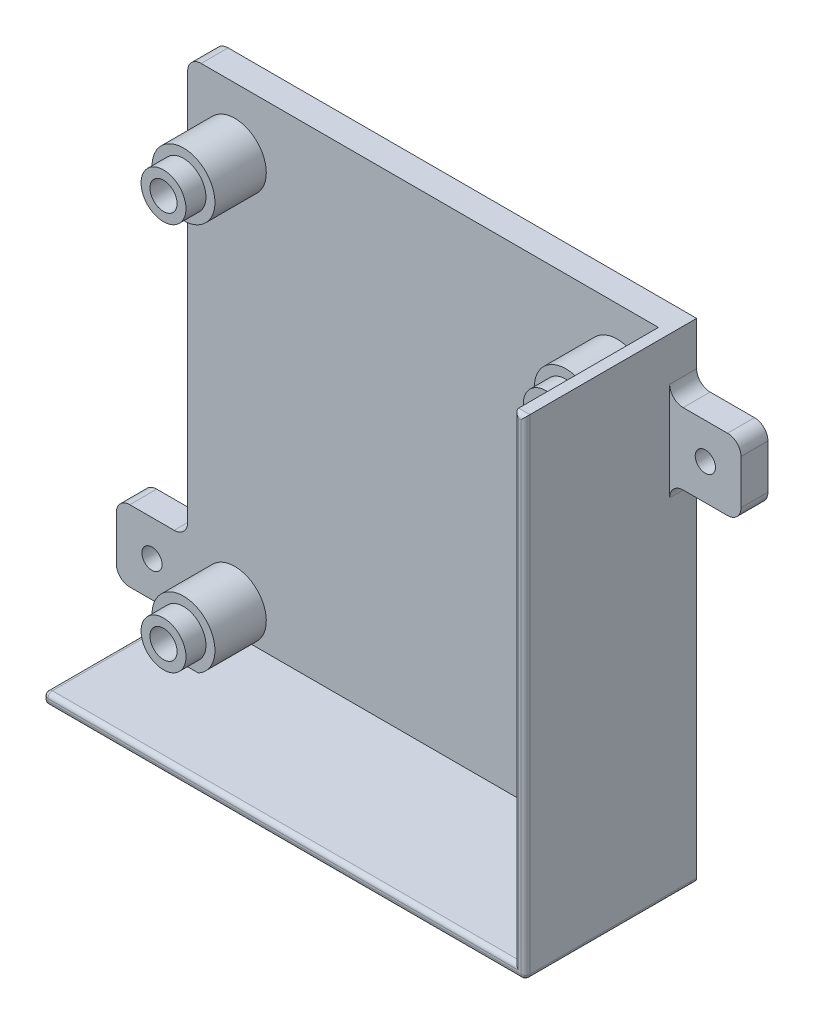
from build123d import *

# Parameters (mm, degrees)
SKETCH1_W            = 104.775
SKETCH1_H            = 106.3625
BOSS_EXTRUDE1_DEPTH  = 6
BOSS_EXTRUDE2_DEPTH  = 38.1
SKETCH3_R            = 5
SKETCH3_R_2          = 3.025
BOSS_EXTRUDE3_DEPTH  = 15.875
SKETCH4_R            = 7
SKETCH4_R_2          = 3.025
BOSS_EXTRUDE4_DEPTH  = 11.43
BOSS_EXTRUDE5_DEPTH  = 6
M4_CLEARANCE_HOLE1_D = 4.5
FILLET2_R            = 3
FILLET3_R            = 1


with BuildPart() as part:
    # Sketch1 → Boss-Extrude1 (new body)
    with BuildSketch(Plane.XY):
        Rectangle(SKETCH1_W, SKETCH1_H)
    extrude(amount=BOSS_EXTRUDE1_DEPTH)

    # Sketch2 → Boss-Extrude2 (add)
    with BuildSketch(Plane.XY):
        Polygon((-52.3875, -53.18125), (-52.3875, -55.68125), (54.8875, -55.68125), (54.8875, 53.18125), (52.3875, 53.18125), (52.3875, -53.18125), align=None)
    extrude(amount=BOSS_EXTRUDE2_DEPTH)

    # Sketch3 → Boss-Extrude3 (add)
    # profile 1 of 4: a face of its own
    with BuildSketch(Plane.XY.offset(6)):
        with Locations((43.208, 39.35095)):
            Circle(SKETCH3_R)
        with Locations((43.208, 39.35095)):
            Circle(SKETCH3_R_2, mode=Mode.SUBTRACT)
    # profile 2 of 4: a face of its own
    with BuildSketch(Plane.XY.offset(6)):
        with Locations((-41.882, 39.35095)):
            Circle(SKETCH3_R)
        with Locations((-41.882, 39.35095)):
            Circle(SKETCH3_R_2, mode=Mode.SUBTRACT)
    # profile 3 of 4: a face of its own
    with BuildSketch(Plane.XY.offset(6)):
        with Locations((-41.882, -47.00905)):
            Circle(SKETCH3_R)
        with Locations((-41.882, -47.00905)):
            Circle(SKETCH3_R_2, mode=Mode.SUBTRACT)
    # profile 4 of 4: a face of its own
    with BuildSketch(Plane.XY.offset(6)):
        with Locations((43.208, -47.00905)):
            Circle(SKETCH3_R)
        with Locations((43.208, -47.00905)):
            Circle(SKETCH3_R_2, mode=Mode.SUBTRACT)
    extrude(amount=BOSS_EXTRUDE3_DEPTH)

    # Sketch4 → Boss-Extrude4 (add)
    # profile 1 of 4: a face of its own
    with BuildSketch(Plane.XY.offset(6)):
        with Locations((43.208, 39.35095)):
            Circle(SKETCH4_R)
        with Locations((43.208, 39.35095)):
            Circle(SKETCH4_R_2, mode=Mode.SUBTRACT)
    # profile 2 of 4: a face of its own
    with BuildSketch(Plane.XY.offset(6)):
        with Locations((-41.882, 39.35095)):
            Circle(SKETCH4_R)
        with Locations((-41.882, 39.35095)):
            Circle(SKETCH4_R_2, mode=Mode.SUBTRACT)
    # profile 3 of 4: a face of its own
    with BuildSketch(Plane.XY.offset(6)):
        with Locations((-41.882, -47.00905)):
            Circle(SKETCH4_R)
        with Locations((-41.882, -47.00905)):
            Circle(SKETCH4_R_2, mode=Mode.SUBTRACT)
    # profile 4 of 4: a face of its own
    with BuildSketch(Plane.XY.offset(6)):
        with Locations((43.208, -47.00905)):
            Circle(SKETCH4_R)
        with Locations((43.208, -47.00905)):
            Circle(SKETCH4_R_2, mode=Mode.SUBTRACT)
    extrude(amount=BOSS_EXTRUDE4_DEPTH)

    # Sketch6 → Boss-Extrude5 (add)
    with BuildSketch(Plane.XY):
        Polygon((-52.3875, -55.68125), (-52.3875, -39.80625), (-68.2625, -39.80625), align=None)
        Polygon((-68.2625, -55.68125), (-68.2625, -39.80625), (-52.3875, -55.68125), align=None)
        Polygon((54.8875, 24.60625), (70.7625, 40.48125), (70.7625, 24.60625), align=None)
        Polygon((54.8875, 40.48125), (54.8875, 24.60625), (70.7625, 40.48125), align=None)
    extrude(amount=BOSS_EXTRUDE5_DEPTH)

    # M4 Clearance Hole1 (through all)
    with Locations(Plane.XY.offset(6)):
        with Locations((62.825, 32.54375), (-60.325, -47.74375)):
            Hole(M4_CLEARANCE_HOLE1_D / 2)

    # Fillet2
    fillet2_edges = [part.edges().sort_by_distance(p)[0] for p in [
        (-52.3875, -39.80625, 3),
        (-68.2625, -39.80625, 3),
        (-68.2625, -55.68125, 3),
        (70.7625, 24.60625, 3),
        (70.7625, 40.48125, 3),
        (54.8875, 40.48125, 3),
        (54.8875, 24.60625, 3),
        (-52.3875, 53.18125, 3),
    ]]
    fillet(fillet2_edges, radius=FILLET2_R)

    # Fillet3
    fillet3_edges = [part.edges().sort_by_distance(p)[0] for p in [
        (-52.3875, -53.18125, 22.05),
        (-52.3875, -55.68125, 22.05),
        (54.8875, -55.68125, 19.05),
        (0, -53.18125, 38.1),
        (-52.3875, -54.43125, 38.1),
        (1.25, -55.68125, 38.1),
        (54.8875, -1.25, 38.1),
        (53.6375, 53.18125, 38.1),
        (52.3875, 0, 38.1),
    ]]
    fillet(fillet3_edges, radius=FILLET3_R)


solid = part.part
